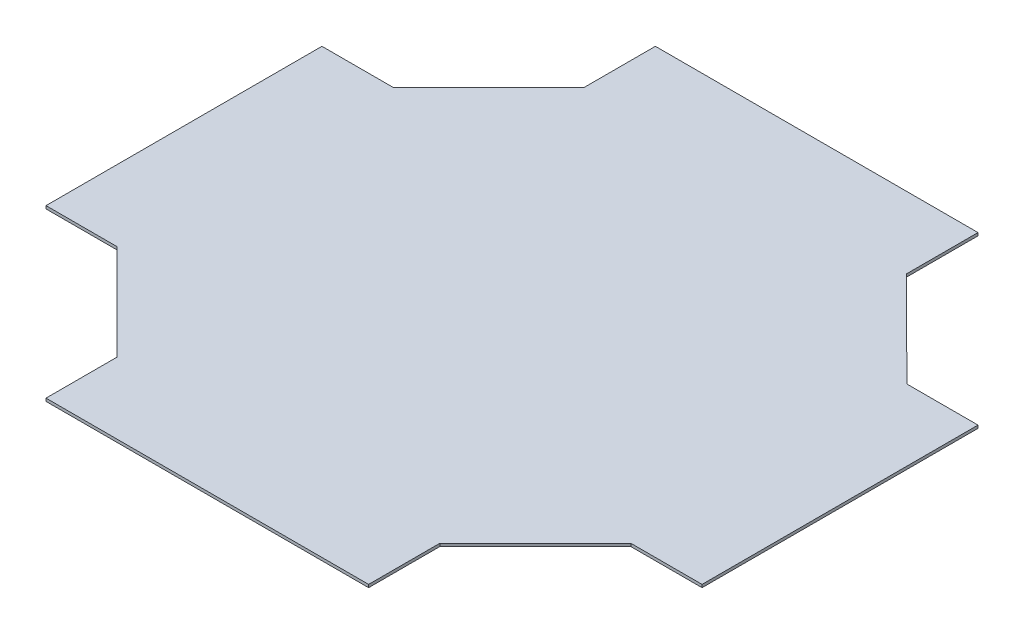
from build123d import *

# Parameters (mm, degrees)
BOSS_EXTRUDE1_DEPTH = 3.175


with BuildPart() as part:
    # Sketch1 → Boss-Extrude1 (new body)
    with BuildSketch(Plane(origin=(0, 0, 0), x_dir=(1, 0, 0), z_dir=(0, 1, 0))):
        Polygon((-166.67981351, 194.859822415), (-245.275331259, 194.859822415), (-245.275331259, -109.940177585), (-166.67981351, -109.940177585), (-61.125331259, -215.494659836), (-61.125331259, -294.090177585), (117.817668741, -294.090177585), (117.055668741, 379.009822415), (-61.125331259, 379.009822415), (-61.125331259, 300.052349659), align=None)
        Polygon((295.236668741, 379.009822415), (117.055668741, 379.009822415), (117.817668741, -294.090177585), (295.236668741, -294.090177585), (295.236668741, -215.494659836), (400.791150992, -109.940177585), (479.386668741, -109.940177585), (479.386668741, 194.859822415), (400.791150992, 194.859822415), (295.236668741, 300.052349659), align=None)
    extrude(amount=BOSS_EXTRUDE1_DEPTH)


solid = part.part
